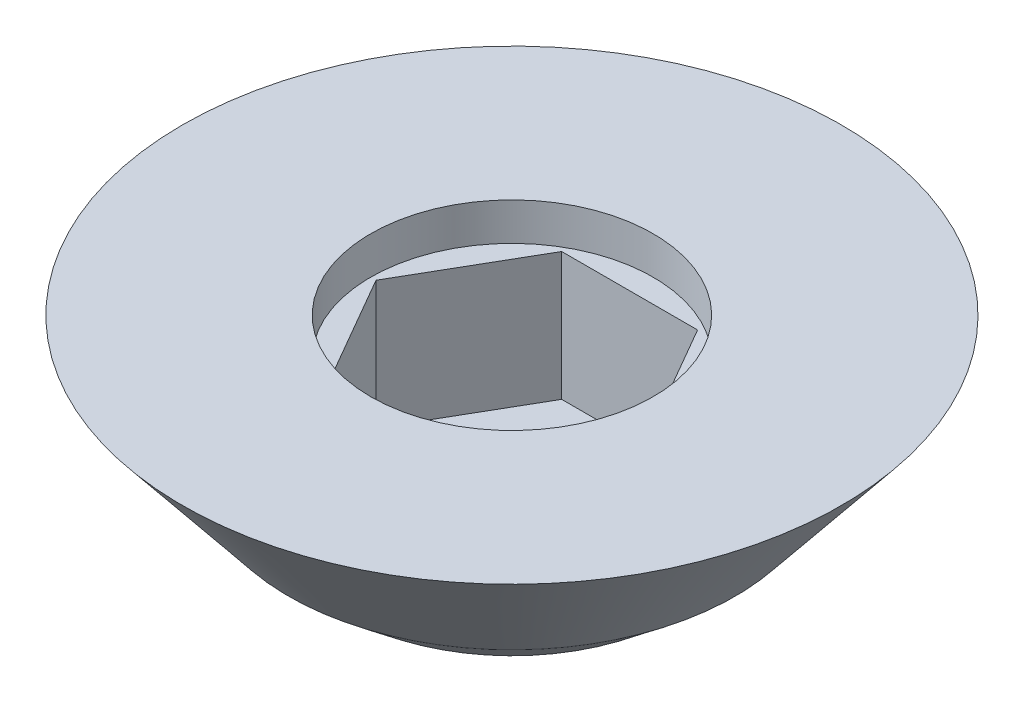
from build123d import *

# Parameters (mm, degrees)
SCHIZZO4_R               = 7.5
TAGLIO_ESTRUSIONE1_DEPTH = 2
TAGLIO_ESTRUSIONE2_DEPTH = 6.8


with BuildPart() as part:
    # Schizzo3 → Rivoluzione1 (revolve)
    with BuildSketch(Plane.XY):
        Polygon((-17.5, 9.3), (0, 9.3), (0, 0), (-9, 0), (-11.850227939, 2.294282645), align=None)
    revolve(axis=Axis((0, 9.3, 0), (0, -1, 0)))

    # Schizzo4 → Taglio-Estrusione1 (cut)
    with BuildSketch(Plane(origin=(0, 9.3, 0), x_dir=(1, 0, 0), z_dir=(0, 1, 0))):
        with Locations(Location((0, 0, 0), (0, 0, 270))):
            Circle(SCHIZZO4_R)
    extrude(amount=-TAGLIO_ESTRUSIONE1_DEPTH, mode=Mode.SUBTRACT)

    # Schizzo5 → Taglio-Estrusione2 (cut)
    with BuildSketch(Plane(origin=(0, 7.3, 0), x_dir=(1, 0, 0), z_dir=(0, 1, 0))):
        Polygon((3.608439182, -6.25), (7.216878365, 0), (3.608439182, 6.25), (-3.608439182, 6.25), (-7.216878365, 0), (-3.608439182, -6.25), align=None)
    extrude(amount=-TAGLIO_ESTRUSIONE2_DEPTH, mode=Mode.SUBTRACT)


solid = part.part
